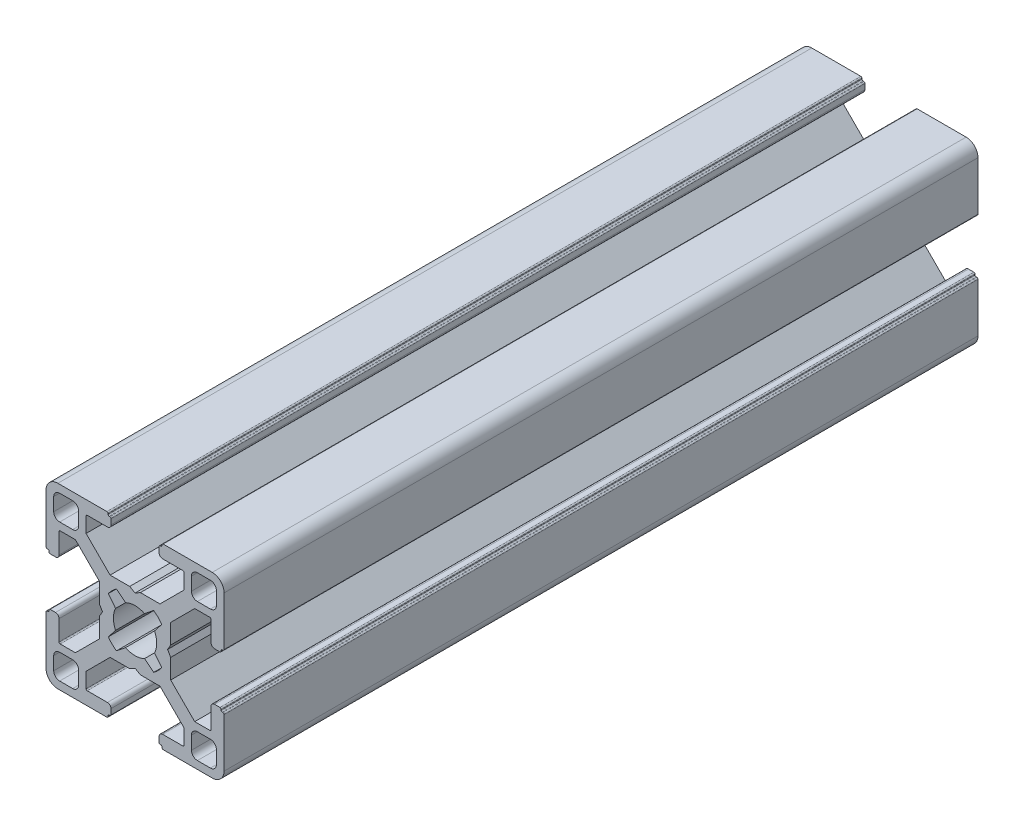
from build123d import *

# Parameters (mm, degrees)
BOSS_EXTRUDE1_DEPTH = 127


with BuildPart() as part:
    # Sketch1 → Boss-Extrude1 (new body)
    with BuildSketch(Plane.XY):
        with BuildLine():
            Line((6.00446543, 0.899999619), (5.484852164, 0))
            Line((5.484852164, 0), (6.00446543, -0.899999619))
            Line((6.00446543, -0.899999619), (6.00446543, -4.204465866))
            Line((6.00446543, -4.204465866), (10.049999564, -8.25))
            Line((10.049999564, -8.25), (12.59999928, -8.25))
            ThreePointArc((12.59999928, -8.25), (12.741420837, -8.191421273), (12.799999564, -8.049999716))
            Line((12.799999564, -8.049999716), (12.799999564, -4.649999613))
            ThreePointArc((12.799999564, -4.649999613), (12.975735606, -4.225735278), (13.39999994, -4.049999237))
            Line((13.39999994, -4.049999237), (14.300000043, -4.049999237))
            ThreePointArc((14.300000043, -4.049999237), (14.4414216, -4.108577964), (14.500000327, -4.249999521))
            Line((14.500000327, -4.249999521), (14.500000327, -4.349998953))
            ThreePointArc((14.500000327, -4.349998953), (14.558579054, -4.49142051), (14.700000611, -4.549999237))
            Line((14.700000611, -4.549999237), (14.799999716, -4.549999237))
            ThreePointArc((14.799999716, -4.549999237), (14.941421273, -4.608577964), (15, -4.749999521))
            Line((15, -4.749999521), (15, -13.000000346))
            ThreePointArc((15, -13.000000346), (14.414213664, -14.414213664), (13.000000346, -15))
            Line((13.000000346, -15), (4.749999945, -15))
            ThreePointArc((4.749999945, -15), (4.60857832, -14.941421245), (4.549999564, -14.799999619))
            Line((4.549999564, -14.799999619), (4.549999564, -14.69999942))
            ThreePointArc((4.549999564, -14.69999942), (4.49142109, -14.558578474), (4.350000144, -14.5))
            Line((4.350000144, -14.5), (4.250000374, -14.5))
            ThreePointArc((4.250000374, -14.5), (4.108578753, -14.441421247), (4.05, -14.299999626))
            Line((4.05, -14.299999626), (4.05, -13.399999434))
            ThreePointArc((4.05, -13.399999434), (4.225735989, -12.975735226), (4.650000197, -12.799999237))
            Line((4.650000197, -12.799999237), (8.049999924, -12.799999237))
            ThreePointArc((8.049999924, -12.799999237), (8.191421565, -12.741420475), (8.250000327, -12.599998834))
            Line((8.250000327, -12.599998834), (8.250000327, -10.049999237))
            Line((8.250000327, -10.049999237), (4.204466193, -6))
            Line((4.204466193, -6), (0.899999946, -6))
            Line((0.899999946, -6), (0, -5.484851837))
            Line((0, -5.484851837), (-0.899999946, -6))
            Line((-0.899999946, -6), (-4.204466193, -6))
            Line((-4.204466193, -6), (-8.250000327, -10.049999237))
            Line((-8.250000327, -10.049999237), (-8.250000327, -12.599998834))
            ThreePointArc((-8.250000327, -12.599998834), (-8.191421565, -12.741420475), (-8.049999924, -12.799999237))
            Line((-8.049999924, -12.799999237), (-4.650000197, -12.799999237))
            ThreePointArc((-4.650000197, -12.799999237), (-4.225735989, -12.975735226), (-4.05, -13.399999434))
            Line((-4.05, -13.399999434), (-4.05, -14.299999626))
            ThreePointArc((-4.05, -14.299999626), (-4.108578753, -14.441421247), (-4.250000374, -14.5))
            Line((-4.250000374, -14.5), (-4.350000144, -14.5))
            ThreePointArc((-4.350000144, -14.5), (-4.49142109, -14.558578474), (-4.549999564, -14.69999942))
            Line((-4.549999564, -14.69999942), (-4.549999564, -14.799999619))
            ThreePointArc((-4.549999564, -14.799999619), (-4.60857832, -14.941421245), (-4.749999945, -15))
            Line((-4.749999945, -15), (-13.000000346, -15))
            ThreePointArc((-13.000000346, -15), (-14.414213664, -14.414213664), (-15, -13.000000346))
            Line((-15, -13.000000346), (-15, -4.749999521))
            ThreePointArc((-15, -4.749999521), (-14.941421273, -4.608577964), (-14.799999716, -4.549999237))
            Line((-14.799999716, -4.549999237), (-14.700000611, -4.549999237))
            ThreePointArc((-14.700000611, -4.549999237), (-14.558579054, -4.49142051), (-14.500000327, -4.349998953))
            Line((-14.500000327, -4.349998953), (-14.500000327, -4.249999521))
            ThreePointArc((-14.500000327, -4.249999521), (-14.4414216, -4.108577964), (-14.300000043, -4.049999237))
            Line((-14.300000043, -4.049999237), (-13.39999994, -4.049999237))
            ThreePointArc((-13.39999994, -4.049999237), (-12.975735606, -4.225735278), (-12.799999564, -4.649999613))
            Line((-12.799999564, -4.649999613), (-12.799999564, -8.049999716))
            ThreePointArc((-12.799999564, -8.049999716), (-12.741420837, -8.191421273), (-12.59999928, -8.25))
            Line((-12.59999928, -8.25), (-10.049999564, -8.25))
            Line((-10.049999564, -8.25), (-6.00446543, -4.204465866))
            Line((-6.00446543, -4.204465866), (-6.00446543, -0.899999619))
            Line((-6.00446543, -0.899999619), (-5.484852164, 0))
            Line((-5.484852164, 0), (-6.00446543, 0.899999619))
            Line((-6.00446543, 0.899999619), (-6.00446543, 4.204465866))
            Line((-6.00446543, 4.204465866), (-10.049999564, 8.25))
            Line((-10.049999564, 8.25), (-12.59999928, 8.25))
            ThreePointArc((-12.59999928, 8.25), (-12.741420837, 8.191421273), (-12.799999564, 8.049999716))
            Line((-12.799999564, 8.049999716), (-12.799999564, 4.649999613))
            ThreePointArc((-12.799999564, 4.649999613), (-12.975735606, 4.225735278), (-13.39999994, 4.049999237))
            Line((-13.39999994, 4.049999237), (-14.300000043, 4.049999237))
            ThreePointArc((-14.300000043, 4.049999237), (-14.4414216, 4.108577964), (-14.500000327, 4.249999521))
            Line((-14.500000327, 4.249999521), (-14.500000327, 4.349998953))
            ThreePointArc((-14.500000327, 4.349998953), (-14.558579054, 4.49142051), (-14.700000611, 4.549999237))
            Line((-14.700000611, 4.549999237), (-14.799999716, 4.549999237))
            ThreePointArc((-14.799999716, 4.549999237), (-14.941421273, 4.608577964), (-15, 4.749999521))
            Line((-15, 4.749999521), (-15, 13.000000346))
            ThreePointArc((-15, 13.000000346), (-14.414213664, 14.414213664), (-13.000000346, 15))
            Line((-13.000000346, 15), (-4.749999945, 15))
            ThreePointArc((-4.749999945, 15), (-4.60857832, 14.941421245), (-4.549999564, 14.799999619))
            Line((-4.549999564, 14.799999619), (-4.549999564, 14.69999942))
            ThreePointArc((-4.549999564, 14.69999942), (-4.49142109, 14.558578474), (-4.350000144, 14.5))
            Line((-4.350000144, 14.5), (-4.250000374, 14.5))
            ThreePointArc((-4.250000374, 14.5), (-4.108578753, 14.441421247), (-4.05, 14.299999626))
            Line((-4.05, 14.299999626), (-4.05, 13.399999434))
            ThreePointArc((-4.05, 13.399999434), (-4.225735989, 12.975735226), (-4.650000197, 12.799999237))
            Line((-4.650000197, 12.799999237), (-8.049999924, 12.799999237))
            ThreePointArc((-8.049999924, 12.799999237), (-8.191421565, 12.741420475), (-8.250000327, 12.599998834))
            Line((-8.250000327, 12.599998834), (-8.250000327, 10.049999237))
            Line((-8.250000327, 10.049999237), (-4.204466193, 6))
            Line((-4.204466193, 6), (-0.899999946, 6))
            Line((-0.899999946, 6), (0, 5.484851837))
            Line((0, 5.484851837), (0.899999946, 6))
            Line((0.899999946, 6), (4.204466193, 6))
            Line((4.204466193, 6), (8.250000327, 10.049999237))
            Line((8.250000327, 10.049999237), (8.250000327, 12.599998834))
            ThreePointArc((8.250000327, 12.599998834), (8.191421565, 12.741420475), (8.049999924, 12.799999237))
            Line((8.049999924, 12.799999237), (4.650000197, 12.799999237))
            ThreePointArc((4.650000197, 12.799999237), (4.225735989, 12.975735226), (4.05, 13.399999434))
            Line((4.05, 13.399999434), (4.05, 14.299999626))
            ThreePointArc((4.05, 14.299999626), (4.108578753, 14.441421247), (4.250000374, 14.5))
            Line((4.250000374, 14.5), (4.350000144, 14.5))
            ThreePointArc((4.350000144, 14.5), (4.49142109, 14.558578474), (4.549999564, 14.69999942))
            Line((4.549999564, 14.69999942), (4.549999564, 14.799999619))
            ThreePointArc((4.549999564, 14.799999619), (4.60857832, 14.941421245), (4.749999945, 15))
            Line((4.749999945, 15), (13.000000346, 15))
            ThreePointArc((13.000000346, 15), (14.414213664, 14.414213664), (15, 13.000000346))
            Line((15, 13.000000346), (15, 4.749999521))
            ThreePointArc((15, 4.749999521), (14.941421273, 4.608577964), (14.799999716, 4.549999237))
            Line((14.799999716, 4.549999237), (14.700000611, 4.549999237))
            ThreePointArc((14.700000611, 4.549999237), (14.558579054, 4.49142051), (14.500000327, 4.349998953))
            Line((14.500000327, 4.349998953), (14.500000327, 4.249999521))
            ThreePointArc((14.500000327, 4.249999521), (14.4414216, 4.108577964), (14.300000043, 4.049999237))
            Line((14.300000043, 4.049999237), (13.39999994, 4.049999237))
            ThreePointArc((13.39999994, 4.049999237), (12.975735606, 4.225735278), (12.799999564, 4.649999613))
            Line((12.799999564, 4.649999613), (12.799999564, 8.049999716))
            ThreePointArc((12.799999564, 8.049999716), (12.741420837, 8.191421273), (12.59999928, 8.25))
            Line((12.59999928, 8.25), (10.049999564, 8.25))
            Line((10.049999564, 8.25), (6.00446543, 4.204465866))
            Line((6.00446543, 4.204465866), (6.00446543, 0.899999619))
        make_face()
        with BuildLine():
            Line((13.70000109, 12.700000398), (13.70000109, 10.499999635))
            ThreePointArc((13.70000109, 10.499999635), (13.407107874, 9.792892851), (12.70000109, 9.499999635))
            Line((12.70000109, 9.499999635), (10.500000327, 9.499999635))
            ThreePointArc((10.500000327, 9.499999635), (9.792893543, 9.792892851), (9.500000327, 10.499999635))
            Line((9.500000327, 10.499999635), (9.500000327, 12.700000398))
            ThreePointArc((9.500000327, 12.700000398), (9.792893543, 13.407107182), (10.500000327, 13.700000398))
            Line((10.500000327, 13.700000398), (12.70000109, 13.700000398))
            ThreePointArc((12.70000109, 13.700000398), (13.407107874, 13.407107182), (13.70000109, 12.700000398))
        make_face(mode=Mode.SUBTRACT)
        with BuildLine():
            Line((3.135929412, 4.518400903), (1.600129524, 3.280561767))
            ThreePointArc((1.600129524, 3.280561767), (0, 3.65), (-1.600129524, 3.280561767))
            Line((-1.600129524, 3.280561767), (-3.135929412, 4.518400903))
            ThreePointArc((-3.135929412, 4.518400903), (-3.881002259, 3.897155561), (-4.505336892, 3.154669473))
            Line((-4.505336892, 3.154669473), (-3.280561732, 1.600129597))
            ThreePointArc((-3.280561732, 1.600129597), (-3.65, 0), (-3.280561732, -1.600129597))
            Line((-3.280561732, -1.600129597), (-4.505336892, -3.154669473))
            ThreePointArc((-4.505336892, -3.154669473), (-3.881002259, -3.897155561), (-3.135929412, -4.518400903))
            Line((-3.135929412, -4.518400903), (-1.600129524, -3.280561767))
            ThreePointArc((-1.600129524, -3.280561767), (0, -3.65), (1.600129524, -3.280561767))
            Line((1.600129524, -3.280561767), (3.135929412, -4.518400903))
            ThreePointArc((3.135929412, -4.518400903), (3.881002259, -3.897155561), (4.505336892, -3.154669473))
            Line((4.505336892, -3.154669473), (3.280561732, -1.600129597))
            ThreePointArc((3.280561732, -1.600129597), (3.65, 0), (3.280561732, 1.600129597))
            Line((3.280561732, 1.600129597), (4.505336892, 3.154669473))
            ThreePointArc((4.505336892, 3.154669473), (3.881002259, 3.897155561), (3.135929412, 4.518400903))
        make_face(mode=Mode.SUBTRACT)
        with BuildLine():
            Line((-13.70000109, -12.700000398), (-13.70000109, -10.499999635))
            ThreePointArc((-13.70000109, -10.499999635), (-13.407107874, -9.792892851), (-12.70000109, -9.499999635))
            Line((-12.70000109, -9.499999635), (-10.500000327, -9.499999635))
            ThreePointArc((-10.500000327, -9.499999635), (-9.792893543, -9.792892851), (-9.500000327, -10.499999635))
            Line((-9.500000327, -10.499999635), (-9.500000327, -12.700000398))
            ThreePointArc((-9.500000327, -12.700000398), (-9.792893543, -13.407107182), (-10.500000327, -13.700000398))
            Line((-10.500000327, -13.700000398), (-12.70000109, -13.700000398))
            ThreePointArc((-12.70000109, -13.700000398), (-13.407107874, -13.407107182), (-13.70000109, -12.700000398))
        make_face(mode=Mode.SUBTRACT)
        with BuildLine():
            Line((10.500000327, -13.700000398), (12.70000109, -13.700000398))
            ThreePointArc((12.70000109, -13.700000398), (13.407107874, -13.407107182), (13.70000109, -12.700000398))
            Line((13.70000109, -12.700000398), (13.70000109, -10.499999635))
            ThreePointArc((13.70000109, -10.499999635), (13.407107874, -9.792892851), (12.70000109, -9.499999635))
            Line((12.70000109, -9.499999635), (10.500000327, -9.499999635))
            ThreePointArc((10.500000327, -9.499999635), (9.792893543, -9.792892851), (9.500000327, -10.499999635))
            Line((9.500000327, -10.499999635), (9.500000327, -12.700000398))
            ThreePointArc((9.500000327, -12.700000398), (9.792893543, -13.407107182), (10.500000327, -13.700000398))
        make_face(mode=Mode.SUBTRACT)
        with BuildLine():
            Line((-10.500000327, 13.700000398), (-12.70000109, 13.700000398))
            ThreePointArc((-12.70000109, 13.700000398), (-13.407107874, 13.407107182), (-13.70000109, 12.700000398))
            Line((-13.70000109, 12.700000398), (-13.70000109, 10.499999635))
            ThreePointArc((-13.70000109, 10.499999635), (-13.407107874, 9.792892851), (-12.70000109, 9.499999635))
            Line((-12.70000109, 9.499999635), (-10.500000327, 9.499999635))
            ThreePointArc((-10.500000327, 9.499999635), (-9.792893543, 9.792892851), (-9.500000327, 10.499999635))
            Line((-9.500000327, 10.499999635), (-9.500000327, 12.700000398))
            ThreePointArc((-9.500000327, 12.700000398), (-9.792893543, 13.407107182), (-10.500000327, 13.700000398))
        make_face(mode=Mode.SUBTRACT)
    extrude(amount=BOSS_EXTRUDE1_DEPTH)


solid = part.part
